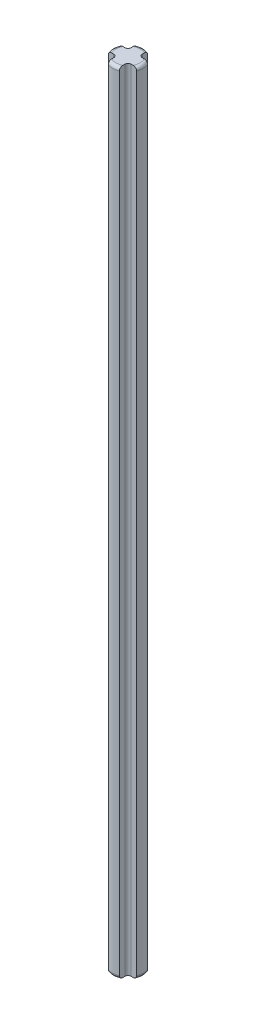
from build123d import *

# Parameters (mm, degrees)
SKETCH1_W          = 2.39
SKETCH1_H          = 124
CUT_EXTRUDE1_DEPTH = 125.046056769
FILLET1_R          = 0.5


with BuildPart() as part:
    # Sketch1 → Revolve1 (revolve)
    with BuildSketch(Plane(origin=(0, 0, 0), x_dir=(-1, 0, 0), z_dir=(0, 0, -1)), mode=Mode.PRIVATE) as revolve1_sk:
        with Locations((-1.195, 62)):
            Rectangle(SKETCH1_W, SKETCH1_H)
    revolve(revolve1_sk.sketch.rotate(Axis((0, 0, 0), (0, 1, 0)), 180), axis=Axis((0, 0, 0), (0, 1, 0)))

    # Sketch2 → Cut-Extrude1 (cut, through all)
    with BuildSketch(Plane.XZ):
        with BuildLine():
            Line((0.875, 2.22406722), (0.875, 0.875))
            Line((0.875, 0.875), (2.22406722, 0.875))
            ThreePointArc((2.22406722, 0.875), (1.689985207, 1.689985207), (0.875, 2.22406722))
        make_face()
        with BuildLine():
            Line((0.875, -0.875), (2.22406722, -0.875))
            ThreePointArc((2.22406722, -0.875), (1.689985207, -1.689985207), (0.875, -2.22406722))
            Line((0.875, -2.22406722), (0.875, -0.875))
        make_face()
        with BuildLine():
            Line((-0.875, -2.22406722), (-0.875, -0.875))
            Line((-0.875, -0.875), (-2.22406722, -0.875))
            ThreePointArc((-2.22406722, -0.875), (-1.689985207, -1.689985207), (-0.875, -2.22406722))
        make_face()
        with BuildLine():
            Line((-0.875, 0.875), (-2.22406722, 0.875))
            ThreePointArc((-2.22406722, 0.875), (-1.689985207, 1.689985207), (-0.875, 2.22406722))
            Line((-0.875, 2.22406722), (-0.875, 0.875))
        make_face()
    extrude(amount=-CUT_EXTRUDE1_DEPTH, mode=Mode.SUBTRACT)

    # Fillet1
    fillet1_edges = [part.edges().sort_by_distance(p)[0] for p in [
        (2.39, 0, 0),
        (0.875, 62, 0.875),
        (0, 124, -2.39),
        (0, 0, -2.39),
        (0.875, 62, -0.875),
        (-2.39, 124, 0),
        (-2.39, 0, 0),
        (-0.875, 62, -0.875),
        (0, 124, 2.39),
        (0, 0, 2.39),
        (-0.875, 62, 0.875),
        (2.39, 124, 0),
    ]]
    fillet(fillet1_edges, radius=FILLET1_R)


solid = part.part
